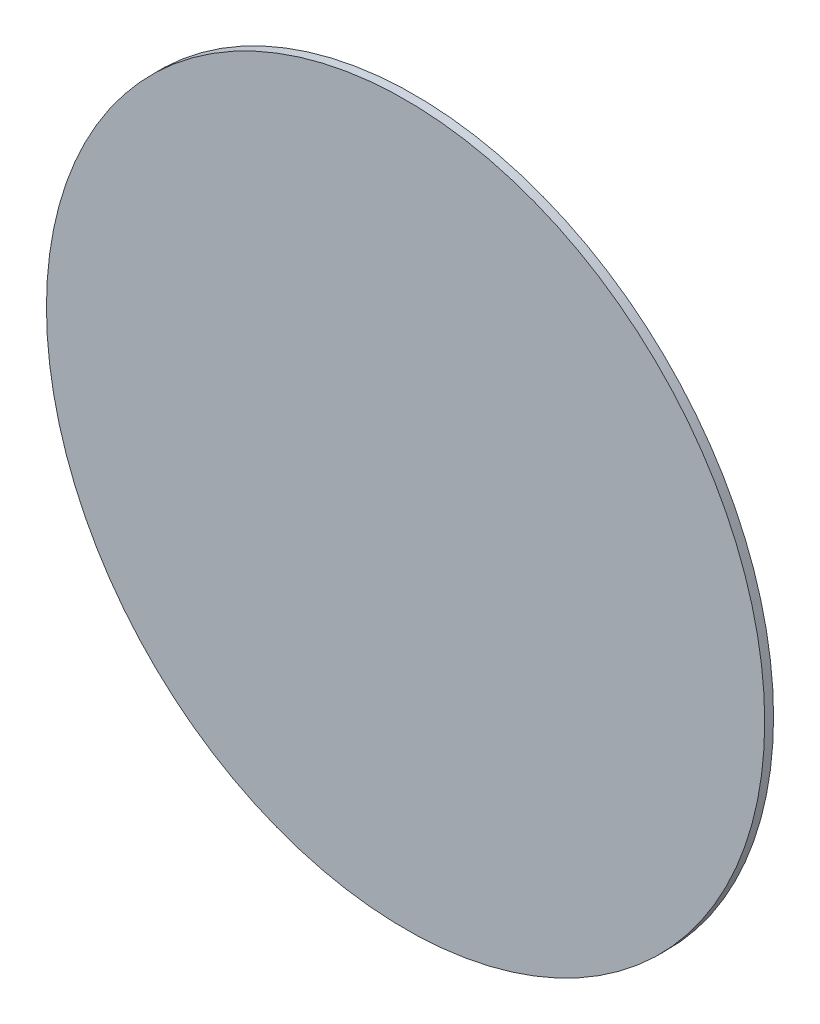
from build123d import *

# Parameters (mm, degrees)
SKETCH1_R           = 65
BOSS_EXTRUDE1_DEPTH = 1.6


with BuildPart() as part:
    # Sketch1 → Boss-Extrude1 (new body)
    with BuildSketch(Plane.XY):
        Circle(SKETCH1_R)
    extrude(amount=BOSS_EXTRUDE1_DEPTH)


solid = part.part
